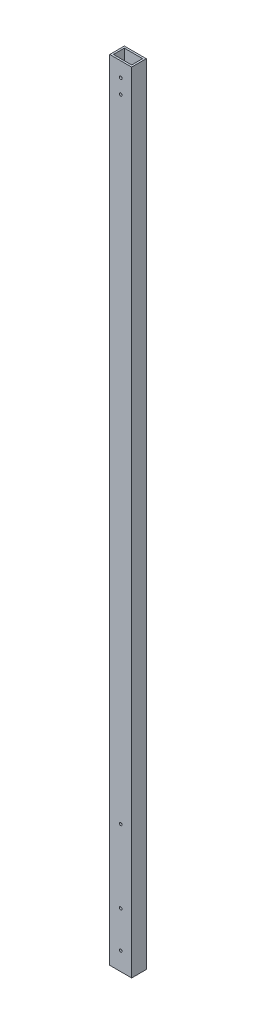
from build123d import *

# Parameters (mm, degrees)
SKETCH2_W           = 38.1
SKETCH2_H           = 25.4
SKETCH2_W_2         = 31.75
SKETCH2_H_2         = 19.05
BOSS_EXTRUDE1_DEPTH = 1371.6
CUT_EXTRUDE1_REACH  = 1373.967
SKETCH3_R           = 2.413
CUT_EXTRUDE2_REACH  = 1373.967
SKETCH4_R           = 2.413


with BuildPart() as part:
    # Sketch2 → Boss-Extrude1 (new body)
    with BuildSketch(Plane(origin=(0, 0, 0), x_dir=(1, 0, 0), z_dir=(0, 1, 0))):
        Rectangle(SKETCH2_W, SKETCH2_H)
        Rectangle(SKETCH2_W_2, SKETCH2_H_2, mode=Mode.SUBTRACT)
    extrude(amount=BOSS_EXTRUDE1_DEPTH)

    # Cut-Extrude1: up to this face of the body (flat: up to its plane)
    cut_extrude1_end = Plane(part.part.faces().sort_by_distance((0, 685.8, -12.7))[0])
    # Sketch3 → Cut-Extrude1 (cut, up to the picked face)
    with BuildSketch(Plane.XY.offset(12.7), mode=Mode.PRIVATE) as cut_extrude1_sk1:
        with Locations((0, 31.75)):
            Circle(SKETCH3_R)
    cut_extrude1_tool1 = split(extrude(cut_extrude1_sk1.sketch, amount=-CUT_EXTRUDE1_REACH, mode=Mode.PRIVATE), bisect_by=cut_extrude1_end, keep=Keep.BOTH, mode=Mode.PRIVATE)
    # Sketch3 → Cut-Extrude1 (cut, up to the picked face)
    with BuildSketch(Plane.XY.offset(12.7), mode=Mode.PRIVATE) as cut_extrude1_sk2:
        with Locations((0, 222.25)):
            Circle(SKETCH3_R)
    cut_extrude1_tool2 = split(extrude(cut_extrude1_sk2.sketch, amount=-CUT_EXTRUDE1_REACH, mode=Mode.PRIVATE), bisect_by=cut_extrude1_end, keep=Keep.BOTH, mode=Mode.PRIVATE)
    # Sketch3 → Cut-Extrude1 (cut, up to the picked face)
    with BuildSketch(Plane.XY.offset(12.7), mode=Mode.PRIVATE) as cut_extrude1_sk3:
        with Locations((0, 95.25)):
            Circle(SKETCH3_R)
    cut_extrude1_tool3 = split(extrude(cut_extrude1_sk3.sketch, amount=-CUT_EXTRUDE1_REACH, mode=Mode.PRIVATE), bisect_by=cut_extrude1_end, keep=Keep.BOTH, mode=Mode.PRIVATE)
    add(cut_extrude1_tool1.solids().sort_by(Axis((0, 31.75, 12.7), (0, 0, -1)))[0], mode=Mode.SUBTRACT)
    add(cut_extrude1_tool2.solids().sort_by(Axis((0, 222.25, 12.7), (0, 0, -1)))[0], mode=Mode.SUBTRACT)
    add(cut_extrude1_tool3.solids().sort_by(Axis((0, 95.25, 12.7), (0, 0, -1)))[0], mode=Mode.SUBTRACT)

    # Cut-Extrude2: up to this face of the body (flat: up to its plane)
    cut_extrude2_end = Plane(part.part.faces().sort_by_distance((0, 686.398541634, -12.7))[0])
    # Sketch4 → Cut-Extrude2 (cut, up to the picked face)
    with BuildSketch(Plane.XY.offset(12.7), mode=Mode.PRIVATE) as cut_extrude2_sk1:
        with Locations((0, 1346.2)):
            Circle(SKETCH4_R)
    cut_extrude2_tool1 = split(extrude(cut_extrude2_sk1.sketch, amount=-CUT_EXTRUDE2_REACH, mode=Mode.PRIVATE), bisect_by=cut_extrude2_end, keep=Keep.BOTH, mode=Mode.PRIVATE)
    # Sketch4 → Cut-Extrude2 (cut, up to the picked face)
    with BuildSketch(Plane.XY.offset(12.7), mode=Mode.PRIVATE) as cut_extrude2_sk2:
        with Locations((0, 1320.8)):
            Circle(SKETCH4_R)
    cut_extrude2_tool2 = split(extrude(cut_extrude2_sk2.sketch, amount=-CUT_EXTRUDE2_REACH, mode=Mode.PRIVATE), bisect_by=cut_extrude2_end, keep=Keep.BOTH, mode=Mode.PRIVATE)
    add(cut_extrude2_tool1.solids().sort_by(Axis((0, 1346.2, 12.7), (0, 0, -1)))[0], mode=Mode.SUBTRACT)
    add(cut_extrude2_tool2.solids().sort_by(Axis((0, 1320.8, 12.7), (0, 0, -1)))[0], mode=Mode.SUBTRACT)


solid = part.part
